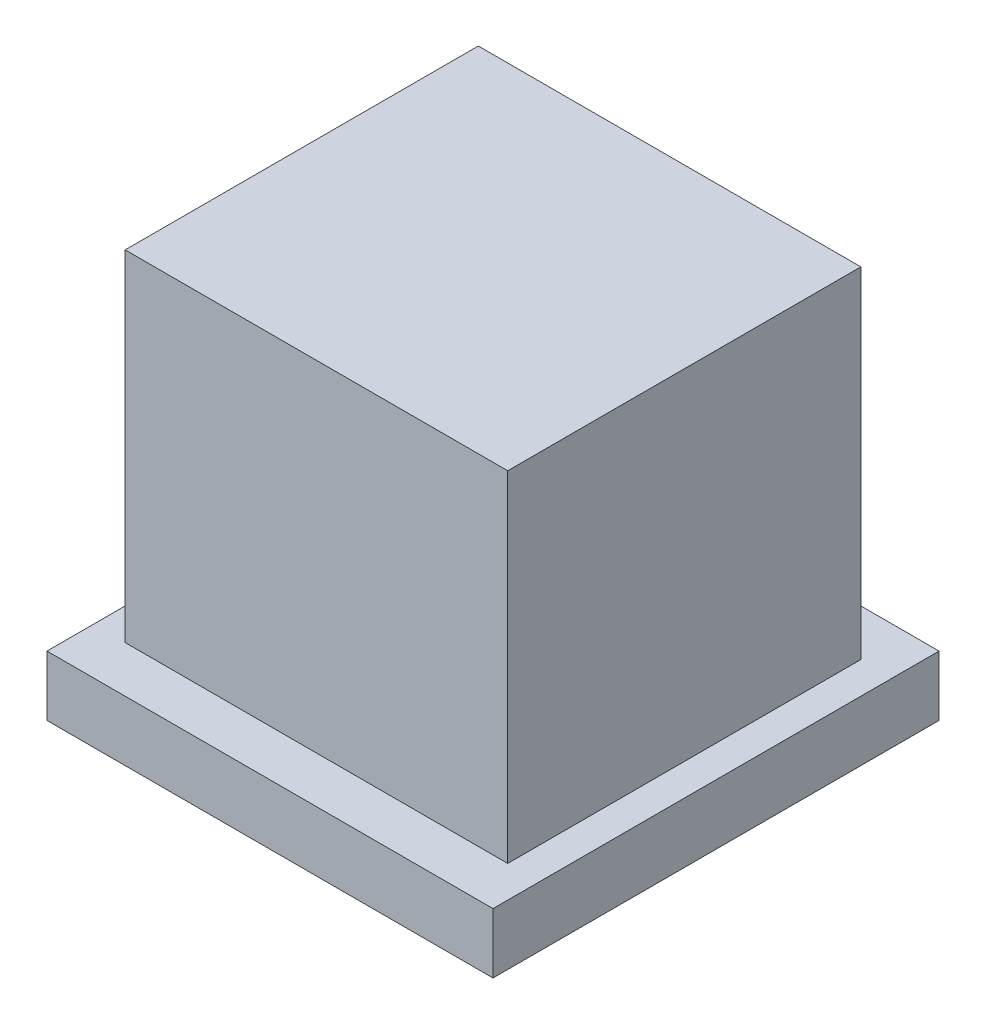
from build123d import *

# Parameters (mm, degrees)
SKETCH1_W           = 26.9494
SKETCH1_H           = 26.9494
BOSS_EXTRUDE1_DEPTH = 3.6322
SKETCH2_W           = 23.114
SKETCH2_H           = 21.336
BOSS_EXTRUDE2_DEPTH = 20.5486
SKETCH3_R           = 2.26691968
SKETCH3_W           = 3.044100844
SKETCH3_H           = 9.672621698
CUT_EXTRUDE1_DEPTH  = 5


with BuildPart() as part:
    # Sketch1 → Boss-Extrude1 (new body)
    with BuildSketch(Plane(origin=(0, 0, 0), x_dir=(1, 0, 0), z_dir=(0, 1, 0))):
        with Locations((13.4747, 13.4747)):
            Rectangle(SKETCH1_W, SKETCH1_H)
    extrude(amount=BOSS_EXTRUDE1_DEPTH)

    # Sketch2 → Boss-Extrude2 (add)
    with BuildSketch(Plane(origin=(0, 3.6322, 0), x_dir=(1, 0, 0), z_dir=(0, 1, 0))):
        with Locations((13.4747, 13.4747)):
            Rectangle(SKETCH2_W, SKETCH2_H)
    extrude(amount=BOSS_EXTRUDE2_DEPTH)

    # Sketch3 → Cut-Extrude1 (cut)
    with BuildSketch(Plane.XZ):
        with Locations(Location((13.4747, -19.796472905, 0), (0, 0, 270))):
            Circle(SKETCH3_R)
        with Locations((7.585585607, -9.270512148)):
            Rectangle(SKETCH3_W, SKETCH3_H)
        with Locations((19.363814393, -9.270512148)):
            Rectangle(SKETCH3_W, SKETCH3_H)
    extrude(amount=-CUT_EXTRUDE1_DEPTH, mode=Mode.SUBTRACT)


solid = part.part
